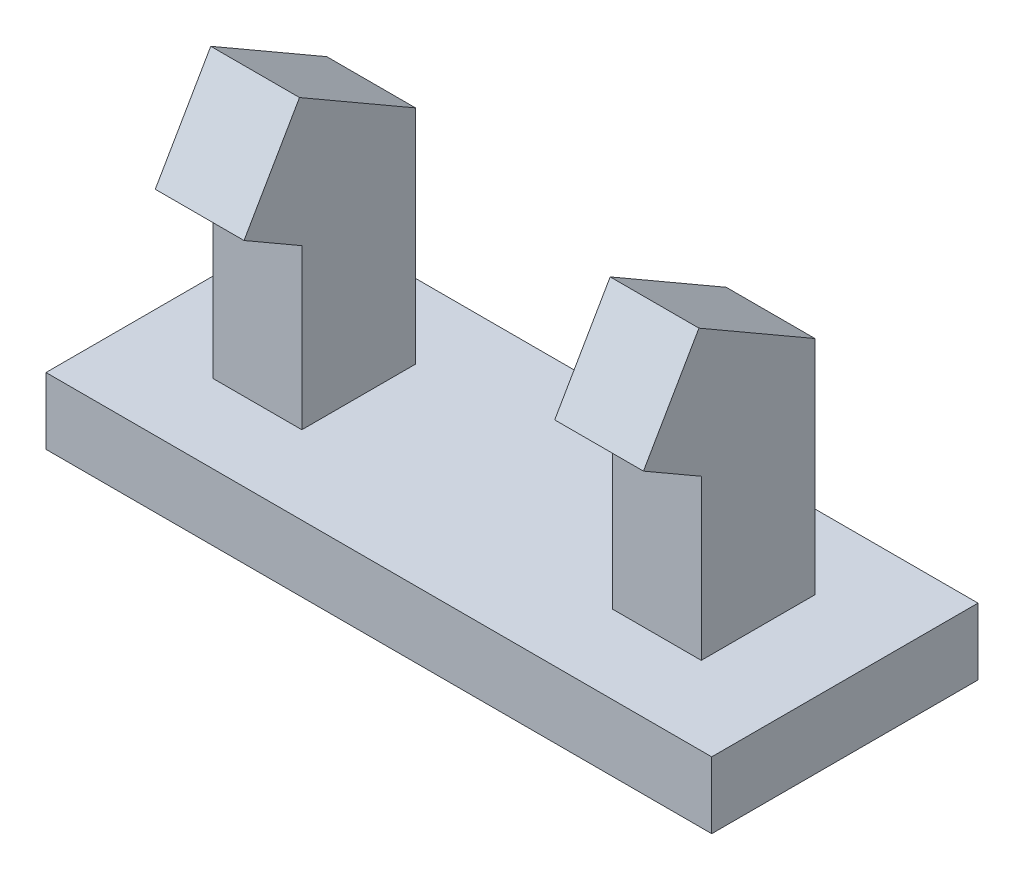
from build123d import *

# Parameters (mm, degrees)
BOSS_EXTRUDE1_DEPTH = 75
CUT_EXTRUDE5_DEPTH  = 20
CUT_EXTRUDE6_DEPTH  = 35


with BuildPart() as part:
    # Sketch1 → Boss-Extrude1 (new body)
    with BuildSketch(Plane(origin=(0, 0, 0), x_dir=(0, 0, -1), z_dir=(1, 0, 0))):
        Polygon((0, 0), (60, 0), (60, 15), (43.266704148, 15), (43.266704148, 65), (17.121672742, 80.09484092), (4.621672742, 58.444205825), (17.650132663, 50.922220983), (17.650132663, 15), (0, 15), align=None)
    boss_extrude1 = extrude(amount=BOSS_EXTRUDE1_DEPTH)

    # Sketch6 → Cut-Extrude5 (cut)
    with BuildSketch(Plane.ZY):
        Polygon((-43.266704148, 15), (-17.650132663, 15), (-17.650132663, 50.922220983), (-4.621672742, 58.444205825), (-17.121672742, 80.09484092), (-43.266704148, 65), align=None)
    cut_extrude5 = extrude(amount=-CUT_EXTRUDE5_DEPTH, mode=Mode.SUBTRACT)

    # Sketch7 → Cut-Extrude6 (cut)
    with BuildSketch(Plane(origin=(75, 0, 0), x_dir=(0, 0, -1), z_dir=(1, 0, 0))):
        Polygon((17.650132663, 15), (43.266704148, 15), (43.266704148, 65), (17.121672742, 80.09484092), (4.621672742, 58.444205825), (17.650132663, 50.922220983), align=None)
    cut_extrude6 = extrude(amount=-CUT_EXTRUDE6_DEPTH, mode=Mode.SUBTRACT)

    # Mirror2: Boss-Extrude1, Cut-Extrude5, Cut-Extrude6 across plane
    add(boss_extrude1.mirror(Plane(origin=(75, 0, 0), x_dir=(0, 0, 1), z_dir=(1, 0, 0))))
    add(cut_extrude5.mirror(Plane(origin=(75, 0, 0), x_dir=(0, 0, 1), z_dir=(1, 0, 0))), mode=Mode.SUBTRACT)
    add(cut_extrude6.mirror(Plane(origin=(75, 0, 0), x_dir=(0, 0, 1), z_dir=(1, 0, 0))), mode=Mode.SUBTRACT)


solid = part.part
